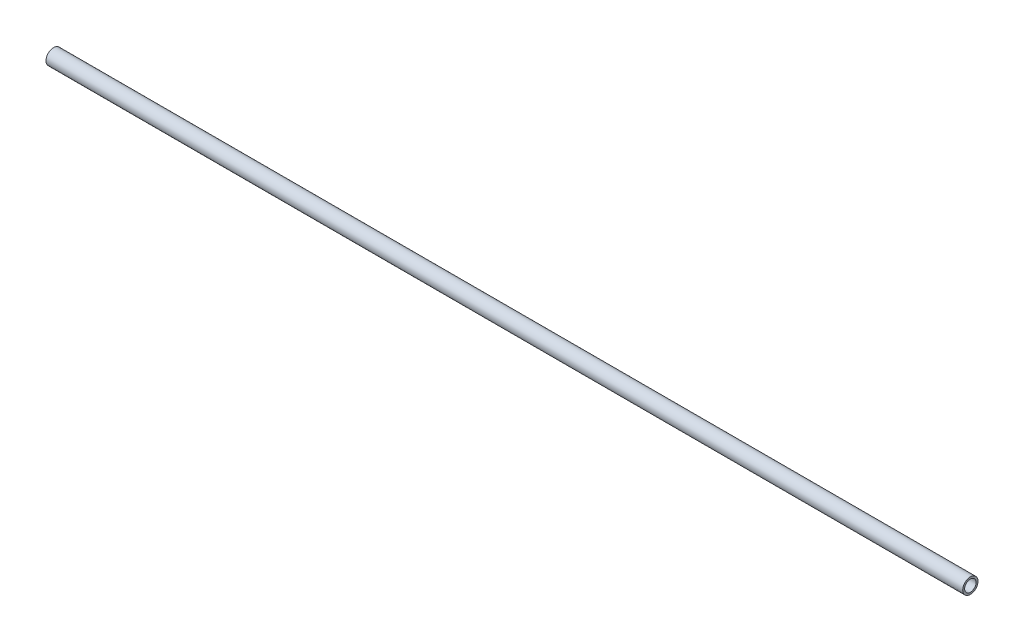
from build123d import *

# Parameters (mm, degrees)
SKETCH2_R           = 12.7
SKETCH2_R_2         = 9.525
BOSS_EXTRUDE1_DEPTH = 1524


with BuildPart() as part:
    # Sketch2 → Boss-Extrude1 (new body)
    with BuildSketch(Plane(origin=(0, 0, 0), x_dir=(0, 0, -1), z_dir=(1, 0, 0))):
        Circle(SKETCH2_R)
        Circle(SKETCH2_R_2, mode=Mode.SUBTRACT)
    extrude(amount=BOSS_EXTRUDE1_DEPTH)


solid = part.part
